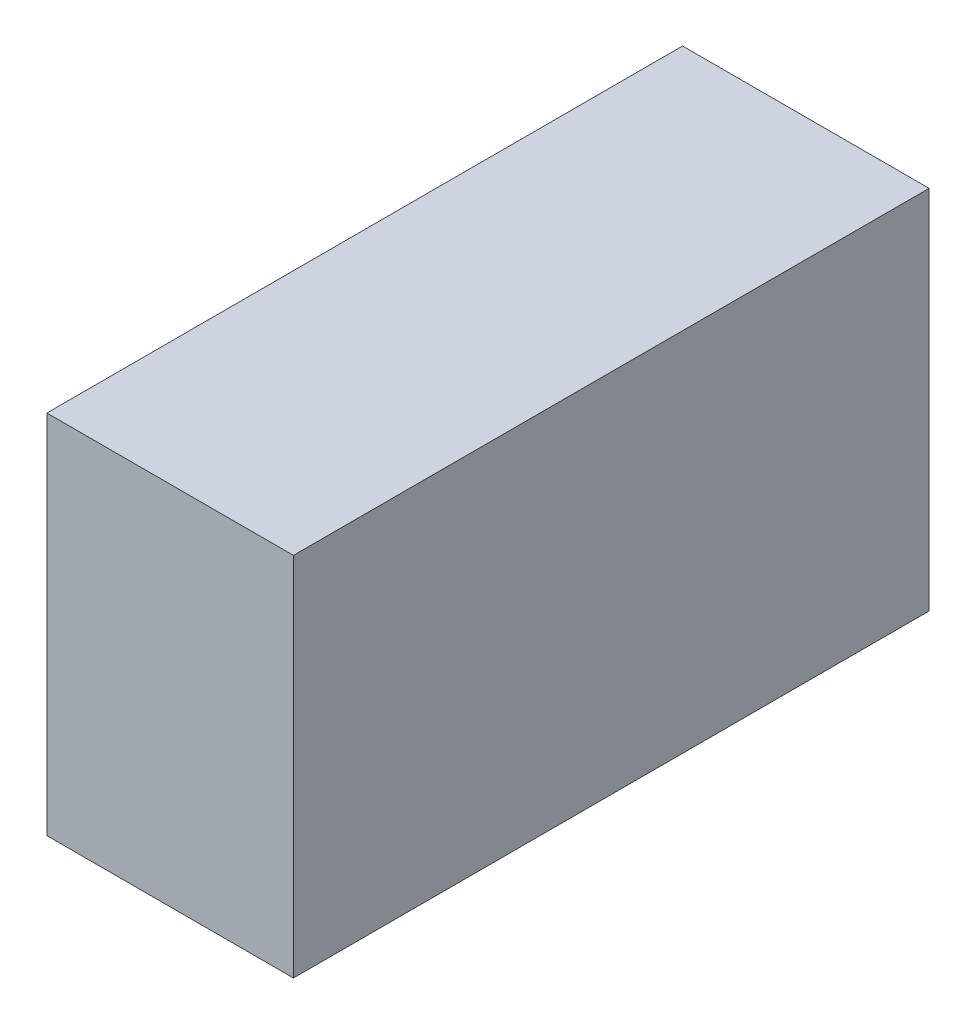
from build123d import *

# Parameters (mm, degrees)
CROQUIS1_W              = 64
CROQUIS1_H              = 95
SALIENTE_EXTRUIR1_DEPTH = 165


with BuildPart() as part:
    # Croquis1 → Saliente-Extruir1 (new body)
    with BuildSketch(Plane.XY):
        with Locations((32, 47.5)):
            Rectangle(CROQUIS1_W, CROQUIS1_H)
    extrude(amount=SALIENTE_EXTRUIR1_DEPTH)


solid = part.part
